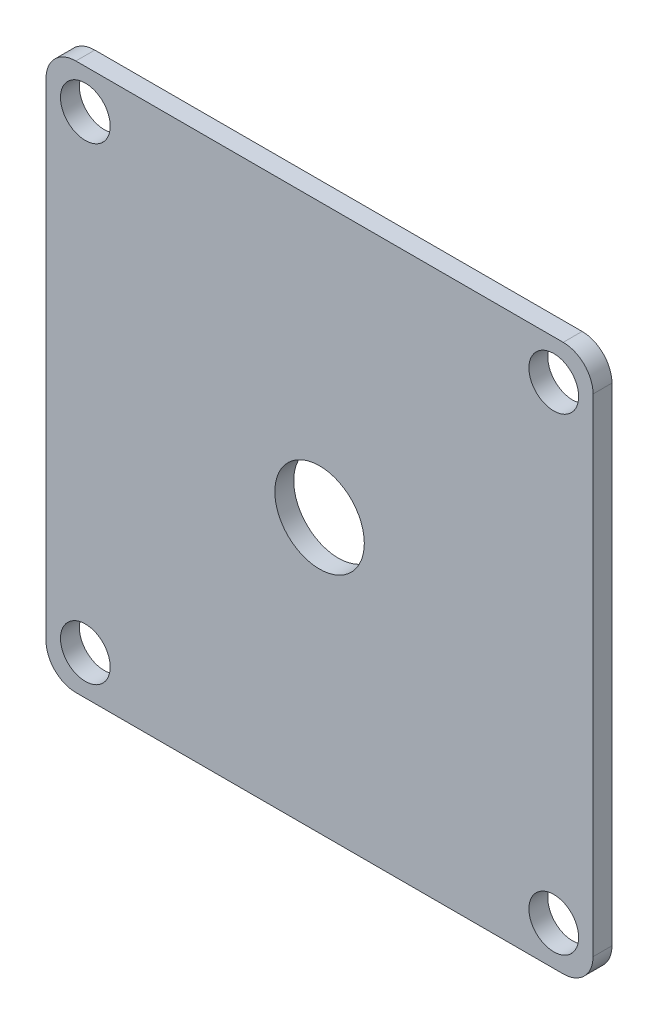
from build123d import *

# Parameters (mm, degrees)
EXTRUDE_1_DEPTH     = 1.9
SKETCH_2_R          = 4.5
CUT_EXTRUDE_1_DEPTH = 78.804948429
SKETCH_3_R          = 2.5
CUT_EXTRUDE_2_DEPTH = 78.804948429


with BuildPart() as part:
    # Эскиз1 → Бобышка-Вытянуть1 (new body)
    with BuildSketch(Plane.XY):
        with BuildLine():
            Line((3, 0), (52, 0))
            ThreePointArc((52, 0), (54.121320344, 0.878679656), (55, 3))
            Line((55, 3), (55, 52))
            ThreePointArc((55, 52), (54.121320344, 54.121320344), (52, 55))
            Line((52, 55), (3, 55))
            ThreePointArc((3, 55), (0.878679656, 54.121320344), (0, 52))
            Line((0, 52), (0, 3))
            ThreePointArc((0, 3), (0.878679656, 0.878679656), (3, 0))
        make_face()
    extrude(amount=EXTRUDE_1_DEPTH)

    # Эскиз2 → Вырез-Вытянуть1 (cut, through all)
    with BuildSketch(Plane.XY.offset(1.9)):
        with Locations((27.5, 27.5)):
            Circle(SKETCH_2_R)
    extrude(amount=-CUT_EXTRUDE_1_DEPTH, mode=Mode.SUBTRACT)

    # Эскиз3 → Вырез-Вытянуть2 (cut, through all)
    with BuildSketch(Plane.XY.offset(1.9)):
        with Locations((3.95, 3.95)):
            Circle(SKETCH_3_R)
        with Locations((51.05, 3.95)):
            Circle(SKETCH_3_R)
        with Locations((51.05, 51.05)):
            Circle(SKETCH_3_R)
        with Locations((3.95, 51.05)):
            Circle(SKETCH_3_R)
    extrude(amount=-CUT_EXTRUDE_2_DEPTH, mode=Mode.SUBTRACT)


solid = part.part
